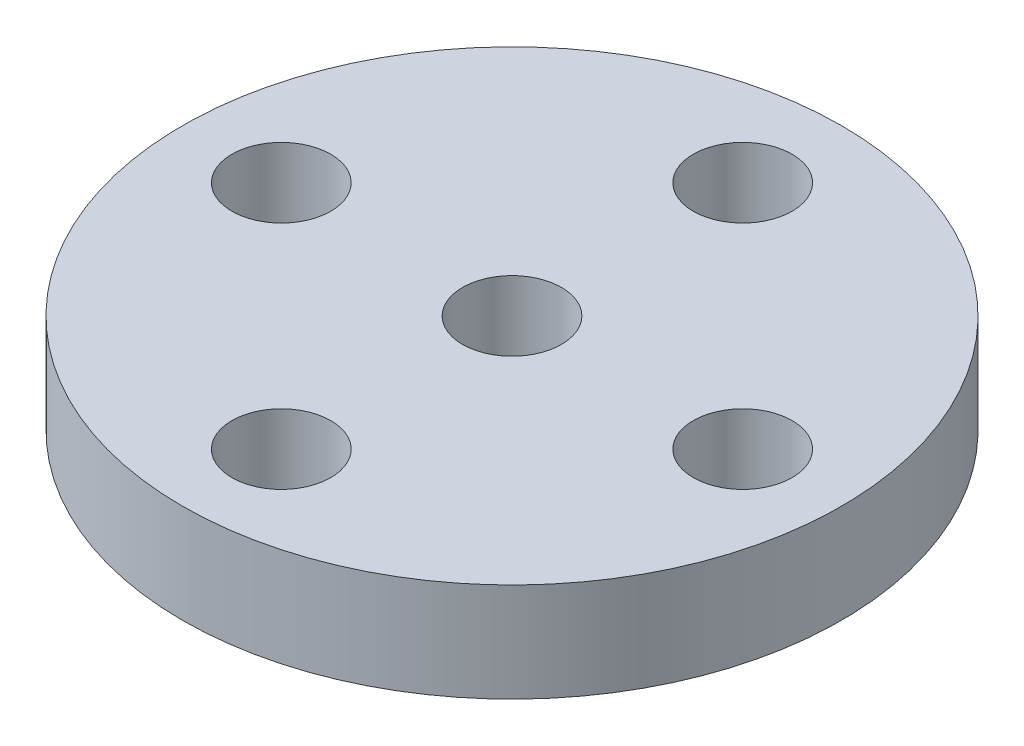
from build123d import *

# Parameters (mm, degrees)
SKETCH_1_R      = 10
SKETCH_1_R_2    = 1.5
EXTRUDE_1_DEPTH = 3


with BuildPart() as part:
    # 草图1 → 凸台-拉伸1 (new body)
    with BuildSketch(Plane(origin=(0, 0, 0), x_dir=(1, 0, 0), z_dir=(0, 1, 0))):
        with Locations(Location((0, 0, 0), (0, 0, 270))):
            Circle(SKETCH_1_R)
        with Locations(Location((0, 7, 0), (0, 0, 270))):
            Circle(SKETCH_1_R_2, mode=Mode.SUBTRACT)
        with Locations(Location((7, 0, 0), (0, 0, 270))):
            Circle(SKETCH_1_R_2, mode=Mode.SUBTRACT)
        with Locations(Location((0, 0, 0), (0, 0, 270))):
            Circle(SKETCH_1_R_2, mode=Mode.SUBTRACT)
        with Locations(Location((0, -7, 0), (0, 0, 90))):
            Circle(SKETCH_1_R_2, mode=Mode.SUBTRACT)
        with Locations(Location((-7, 0, 0), (0, 0, 90))):
            Circle(SKETCH_1_R_2, mode=Mode.SUBTRACT)
    extrude(amount=EXTRUDE_1_DEPTH)


solid = part.part
